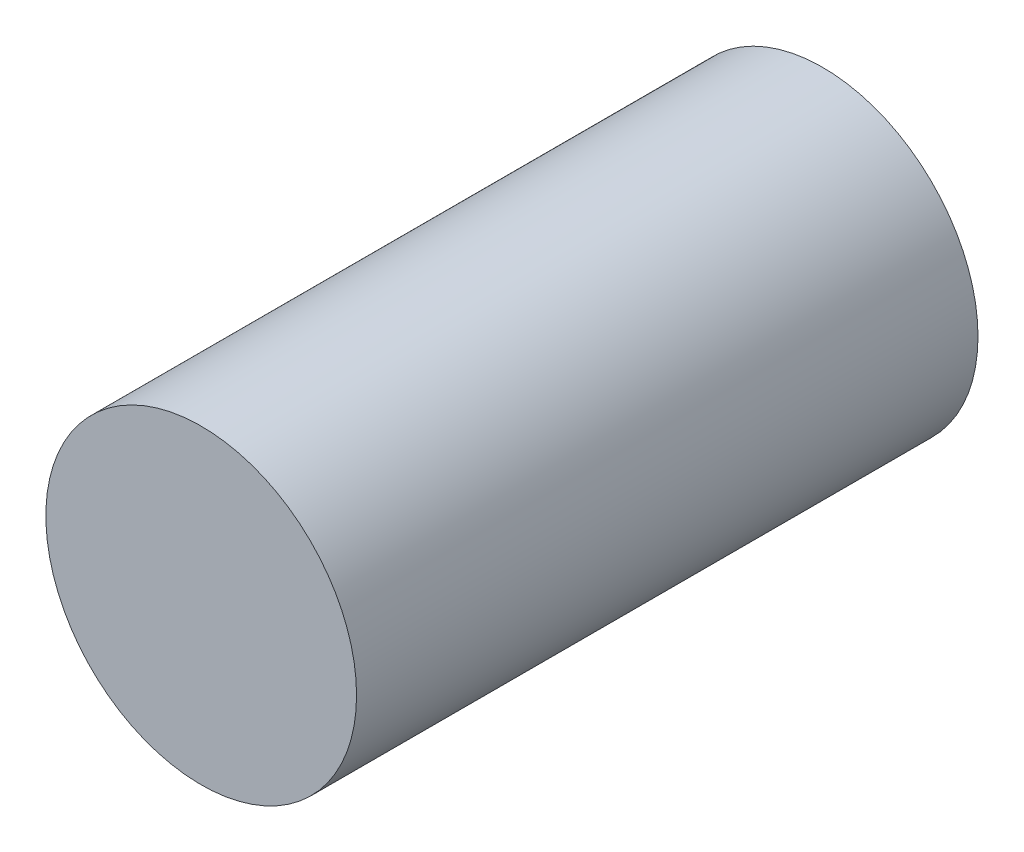
from build123d import *

# Parameters (mm, degrees)
CROQUIS1_R              = 7.5
SALIENTE_EXTRUIR1_DEPTH = 30


with BuildPart() as part:
    # Croquis1 → Saliente-Extruir1 (new body)
    with BuildSketch(Plane.XY):
        Circle(CROQUIS1_R)
    extrude(amount=SALIENTE_EXTRUIR1_DEPTH)


solid = part.part
